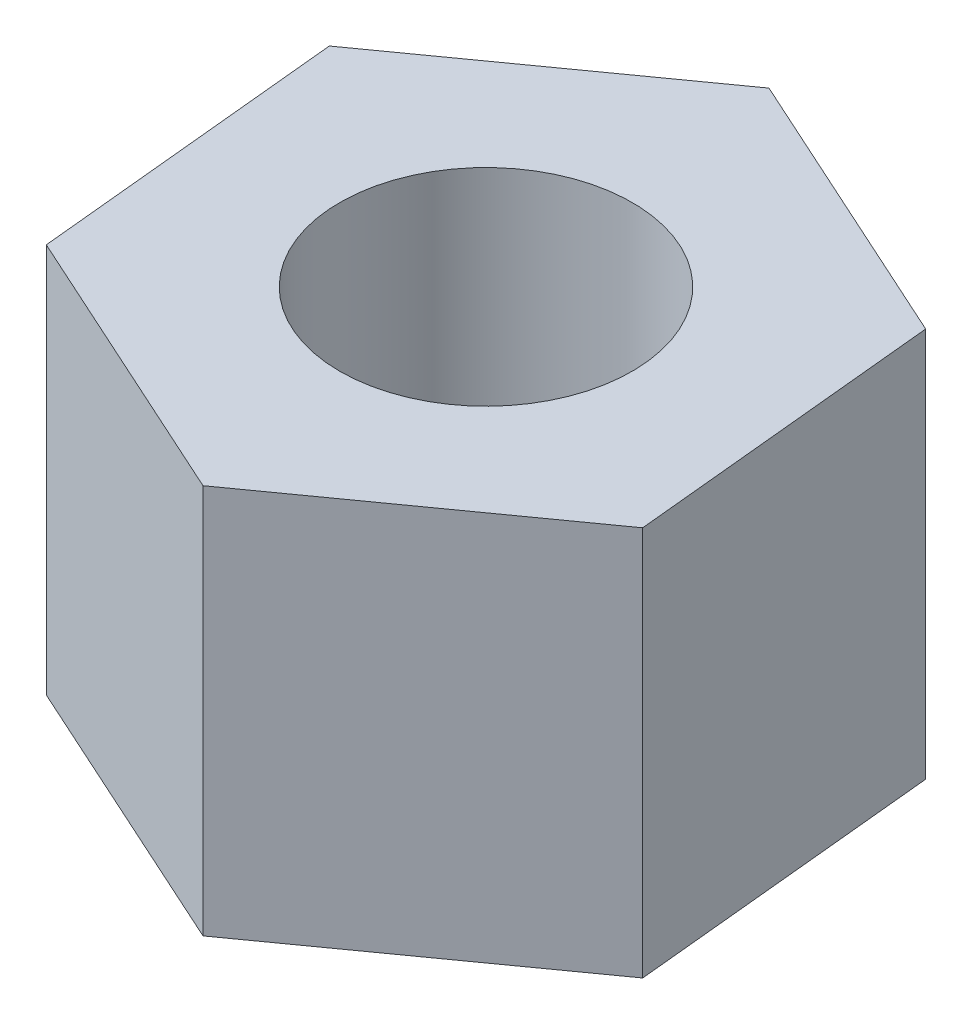
from build123d import *

# Parameters (mm, degrees)
SKETCH_1_R      = 1.5
EXTRUDE_1_DEPTH = 4


with BuildPart() as part:
    # 草图1 → 凸台-拉伸1 (new body)
    with BuildSketch(Plane(origin=(0, 0, 0), x_dir=(1, 0, 0), z_dir=(0, 1, 0))):
        Polygon((2.944024799, -1.33643231), (2.62939673, 1.88138411), (-0.314628068, 3.21781642), (-2.944024799, 1.33643231), (-2.62939673, -1.88138411), (0.314628068, -3.21781642), align=None)
        with Locations(Location((0, 0, 0), (0, 0, 270))):
            Circle(SKETCH_1_R, mode=Mode.SUBTRACT)
    extrude(amount=EXTRUDE_1_DEPTH)


solid = part.part
